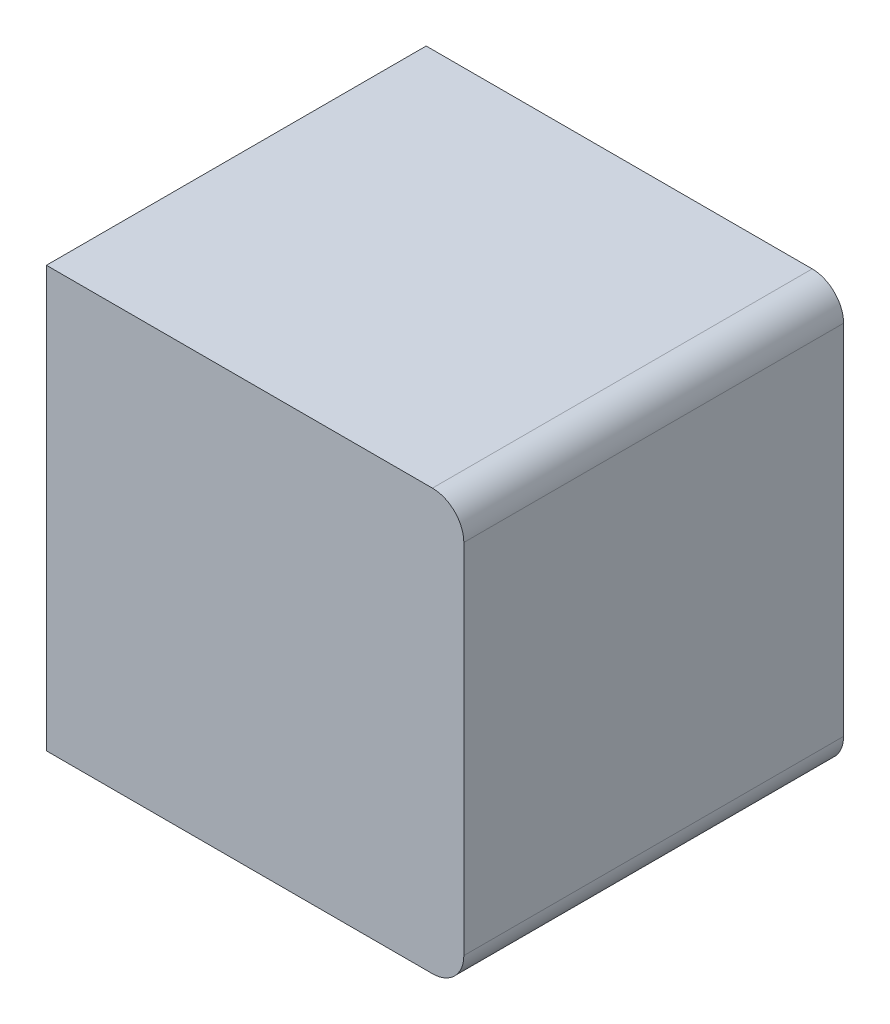
from build123d import *

# Parameters (mm, degrees)
EXTRUDE_1_DEPTH = 60.5


with BuildPart() as part:
    # 草图1 → 凸台-拉伸1 (new body)
    with BuildSketch(Plane.XY):
        with BuildLine():
            Line((-38.25, 29.328205128), (23.25, 29.328205128))
            ThreePointArc((23.25, 29.328205128), (26.785533906, 27.863739034), (28.25, 24.328205128))
            Line((28.25, 24.328205128), (28.25, -32.671794872))
            ThreePointArc((28.25, -32.671794872), (26.785533906, -36.207328778), (23.25, -37.671794872))
            Line((23.25, -37.671794872), (-38.25, -37.671794872))
            Line((-38.25, -37.671794872), (-38.25, 29.328205128))
        make_face()
    extrude(amount=-EXTRUDE_1_DEPTH)


solid = part.part
